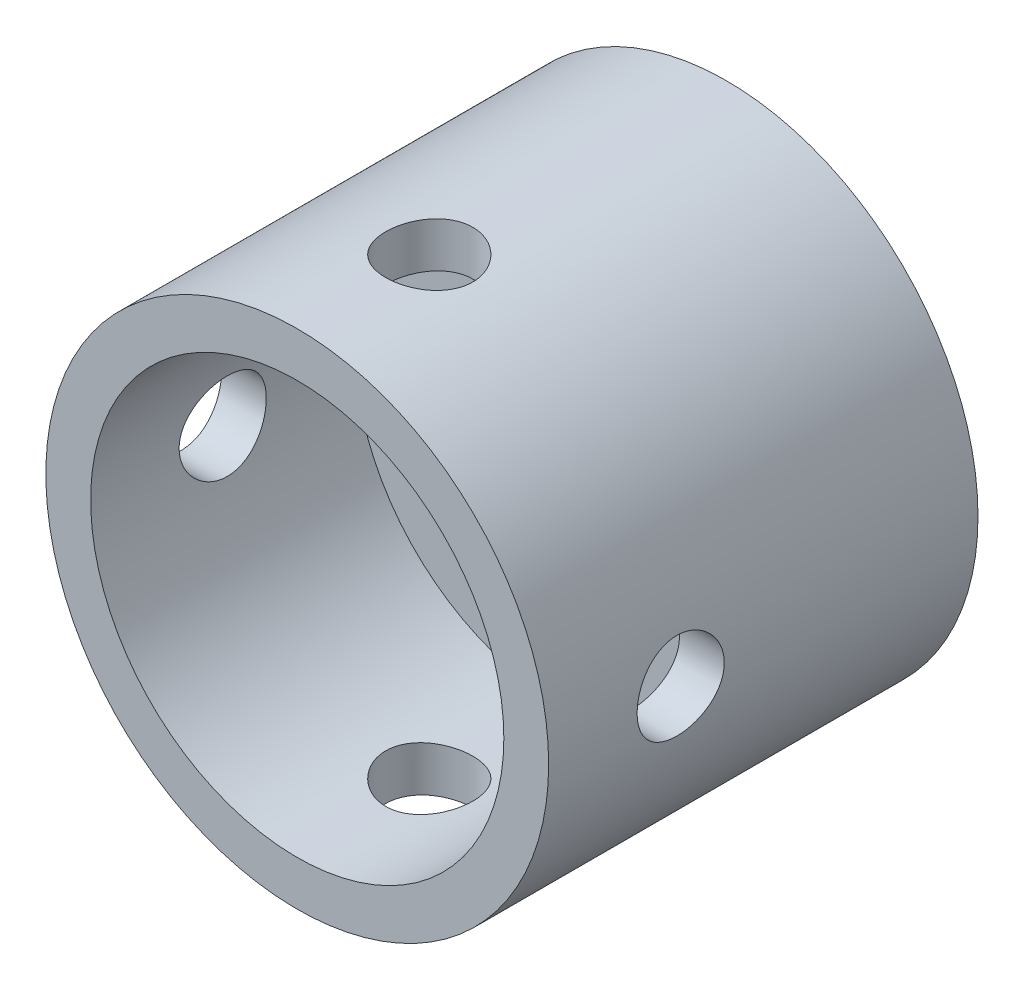
from build123d import *

# Parameters (mm, degrees)
F_4_CLEARANCE_HOLE1_REACH  = 26.911
F_4_CLEARANCE_HOLE1_BORE_R = 1.4732
CIRPATTERN1_COUNT          = 4


with BuildPart() as part:
    # Sketch1 → Revolve1 (revolve)
    with BuildSketch(Plane(origin=(0, 0, 0), x_dir=(0, 0, -1), z_dir=(1, 0, 0)), mode=Mode.PRIVATE) as revolve1_sk:
        Polygon((-7.175000128, 6.985), (-7.175000128, 4.500000017), (-3.175, 4.500000017), (-3.175, 3.499999985), (-1.5875, 3.499999985), (-1.5875, 8.500000018), (-16.103100128, 8.500000018), (-16.103100128, 6.985), align=None)
    revolve(revolve1_sk.sketch.rotate(Axis((0, 0, 9.953125128), (0, 0, -1)), 90), axis=Axis((0, 0, 9.953125128), (0, 0, -1)))

    # #4 Clearance Hole1 bore → #4 Clearance Hole1 (cut, up to next)
    with BuildSketch(Plane(origin=(0, 8.500000018, 0), x_dir=(1, 0, 0), z_dir=(0, 1, 0)), mode=Mode.PRIVATE) as f_4_clearance_hole1_sk1:
        with Locations((0, -11.639050128)):
            Circle(F_4_CLEARANCE_HOLE1_BORE_R)
    f_4_clearance_hole1_tool1 = extrude(f_4_clearance_hole1_sk1.sketch, amount=-F_4_CLEARANCE_HOLE1_REACH, mode=Mode.PRIVATE) & part.part
    f_4_clearance_hole1 = f_4_clearance_hole1_tool1.solids().sort_by_distance((0, 8.5, 11.63905))[0]
    add(f_4_clearance_hole1, mode=Mode.SUBTRACT)

    # CirPattern1: #4 Clearance Hole1 ×4 about axis
    cirpattern1_axis = Axis((0, 0, 9.953125128), (0, 0, 1))
    for i in range(1, CIRPATTERN1_COUNT):
        add(f_4_clearance_hole1.rotate(cirpattern1_axis, i * 360 / CIRPATTERN1_COUNT), mode=Mode.SUBTRACT)


solid = part.part
